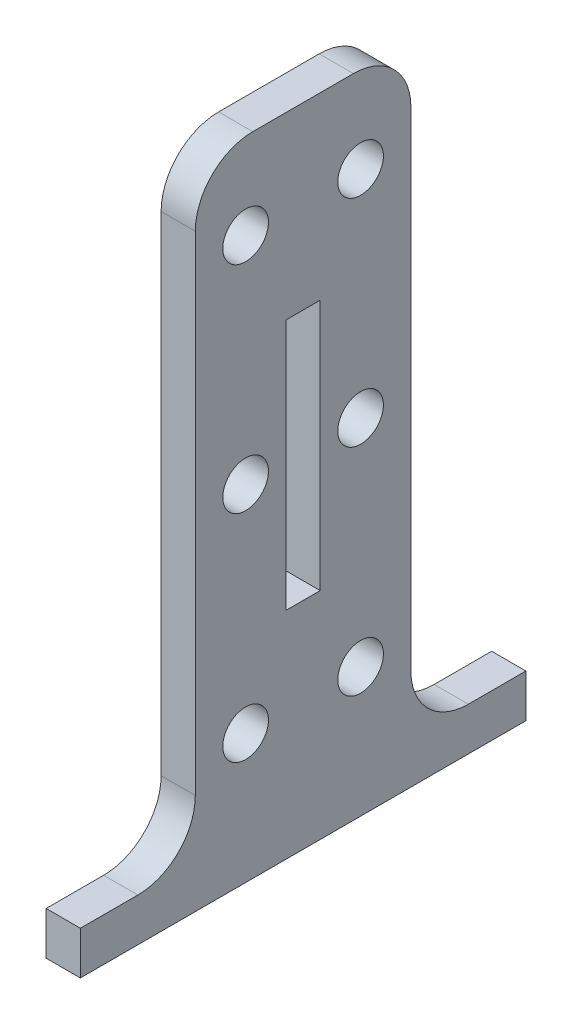
from build123d import *

# Parameters (mm, degrees)
RESSALTO_EXTRUS_O1_DEPTH   = 30
ESBO_O2_W                  = 12
ESBO_O2_H                  = 94
CORTE_EXTRUS_O1_DEPTH      = 118.541482039
ESBO_O3_W                  = 30
ESBO_O3_H                  = 10
CORTE_EXTRUS_O2_DEPTH      = 118.541482039
ESBO_O4_W                  = 3.6
ESBO_O4_H                  = 30
CORTE_EXTRUS_O3_DEPTH      = 108.498837203
ESBO_O5_W                  = 56.4
ESBO_O5_H                  = 6
RESSALTO_EXTRUS_O2_DEPTH   = 16
ESBO_O6_W                  = 56.4
ESBO_O6_H                  = 6
RESSALTO_EXTRUS_O3_DEPTH   = 16
FILETE1_R                  = 8
FILETE2_R                  = 8
FILETE3_R                  = 8
FILETE4_R                  = 4
ESBO_O7_R                  = 3.175
CORTE_EXTRUS_O4_DEPTH      = 113.943171551
ESBO_O8_R                  = 3.25
CORTE_EXTRUS_O5_DEPTH      = 112.143870726
CORTE_EXTRUS_O6_DEPTH      = 113.943171551
CORTE_EXTRUS_O6_DEPTH_BACK = 1.24
ESBO_O9_W                  = 62
ESBO_O9_H                  = 90
ESBO_O10_W                 = 4.76
ESBO_O10_H                 = 130
CORTE_EXTRUS_O7_DEPTH      = 102.186252031
ESBO_O11_W                 = 4.76
ESBO_O11_H                 = 30
RESSALTO_EXTRUS_O4_DEPTH   = 4.76


with BuildPart() as part:
    # Esboço1 → Ressalto-extrusão1 (new body)
    with BuildSketch(Plane.XY):
        Polygon((0, 0), (0, 100), (60, 0), align=None)
    extrude(amount=RESSALTO_EXTRUS_O1_DEPTH)

    # Esboço2 → Corte-extrusão1 (cut, through all)
    with BuildSketch(Plane.ZY.offset(-6)):
        with Locations((24, 53)):
            Rectangle(ESBO_O2_W, ESBO_O2_H)
        with Locations((6, 53)):
            Rectangle(ESBO_O2_W, ESBO_O2_H)
    extrude(amount=-CORTE_EXTRUS_O1_DEPTH, mode=Mode.SUBTRACT)

    # Esboço3 → Corte-extrusão2 (cut, through all)
    with BuildSketch(Plane(origin=(6, 0, 0), x_dir=(0, 0, -1), z_dir=(1, 0, 0))):
        with Locations((-15, 95)):
            Rectangle(ESBO_O3_W, ESBO_O3_H)
    extrude(amount=-CORTE_EXTRUS_O2_DEPTH, mode=Mode.SUBTRACT)

    # Esboço4 → Corte-extrusão3 (cut, through all)
    with BuildSketch(Plane(origin=(0, 6, 0), x_dir=(1, 0, 0), z_dir=(0, 1, 0))):
        with Locations((58.2, -15)):
            Rectangle(ESBO_O4_W, ESBO_O4_H)
    extrude(amount=-CORTE_EXTRUS_O3_DEPTH, mode=Mode.SUBTRACT)

    # Esboço5 → Ressalto-extrusão2 (add)
    with BuildSketch(Plane.XY.offset(30)):
        with Locations((28.2, 3)):
            Rectangle(ESBO_O5_W, ESBO_O5_H)
    extrude(amount=RESSALTO_EXTRUS_O2_DEPTH)

    # Esboço6 → Ressalto-extrusão3 (add)
    with BuildSketch(Plane(origin=(0, 0, 0), x_dir=(-1, 0, 0), z_dir=(0, 0, -1))):
        with Locations((-28.2, 3)):
            Rectangle(ESBO_O6_W, ESBO_O6_H)
    extrude(amount=RESSALTO_EXTRUS_O3_DEPTH)

    # Filete1
    filete1_edges = [part.edges().sort_by_distance(p)[0] for p in [
        (3, 6, 0),
        (3, 6, 30),
    ]]
    fillet(filete1_edges, radius=FILETE1_R)

    # Filete2
    filete2_edges = [part.edges().sort_by_distance(p)[0] for p in [
        (56.4, 3, -16),
        (56.4, 3, 46),
    ]]
    fillet(filete2_edges, radius=FILETE2_R)

    # Filete3
    filete3_edges = [part.edges().sort_by_distance(p)[0] for p in [
        (3, 90, 30),
        (3, 90, 0),
    ]]
    fillet(filete3_edges, radius=FILETE3_R)

    # Filete4
    filete4_edges = [part.edges().sort_by_distance(p)[0] for p in [
        (31.2, 6, 18),
        (31.2, 6, 12),
    ]]
    fillet(filete4_edges, radius=FILETE4_R)

    # Esboço7 → Corte-extrusão4 (cut, through all)
    with BuildSketch(Plane(origin=(6, 0, 0), x_dir=(0, 0, -1), z_dir=(1, 0, 0))):
        with Locations((-23, 78)):
            Circle(ESBO_O7_R)
        with Locations((-23, 48)):
            Circle(ESBO_O7_R)
        with Locations((-23, 18)):
            Circle(ESBO_O7_R)
        with Locations(Location((-7, 18, 0), (0, 0, 180))):
            Circle(ESBO_O7_R)
        with Locations(Location((-7, 48, 0), (0, 0, 180))):
            Circle(ESBO_O7_R)
        with Locations(Location((-7, 78, 0), (0, 0, 180))):
            Circle(ESBO_O7_R)
    extrude(amount=-CORTE_EXTRUS_O4_DEPTH, mode=Mode.SUBTRACT)

    # Esboço8 → Corte-extrusão5 (cut, through all)
    with BuildSketch(Plane(origin=(0, 6, 0), x_dir=(1, 0, 0), z_dir=(0, 1, 0))):
        with Locations(Location((48.4, 8, 0), (0, 0, 270))):
            Circle(ESBO_O8_R)
        with Locations(Location((48.4, -38, 0), (0, 0, 270))):
            Circle(ESBO_O8_R)
        with Locations(Location((16.4, -38, 0), (0, 0, 270))):
            Circle(ESBO_O8_R)
        with Locations(Location((16.4, 8, 0), (0, 0, 270))):
            Circle(ESBO_O8_R)
    extrude(amount=-CORTE_EXTRUS_O5_DEPTH, mode=Mode.SUBTRACT)

    # Esboço9 → Corte-extrusão6 (cut, two sides: drawn at the far end of the back side and taken through both)
    with BuildSketch(Plane(origin=(6, 0, 0), x_dir=(0, 0, -1), z_dir=(1, 0, 0)).offset(-CORTE_EXTRUS_O6_DEPTH_BACK)):
        with Locations((-15, 45)):
            Rectangle(ESBO_O9_W, ESBO_O9_H)
    extrude(amount=CORTE_EXTRUS_O6_DEPTH + CORTE_EXTRUS_O6_DEPTH_BACK, mode=Mode.SUBTRACT)

    # Esboço10 → Corte-extrusão7 (cut, through all)
    with BuildSketch(Plane.ZY):
        with Locations((15, 0)):
            Rectangle(ESBO_O10_W, ESBO_O10_H)
    extrude(amount=-CORTE_EXTRUS_O7_DEPTH, mode=Mode.SUBTRACT)

    # Esboço11 → Ressalto-extrusão4 (add, through all)
    with BuildSketch(Plane.ZY):
        with Locations((15, 15)):
            Rectangle(ESBO_O11_W, ESBO_O11_H)
    extrude(amount=-RESSALTO_EXTRUS_O4_DEPTH)


solid = part.part
